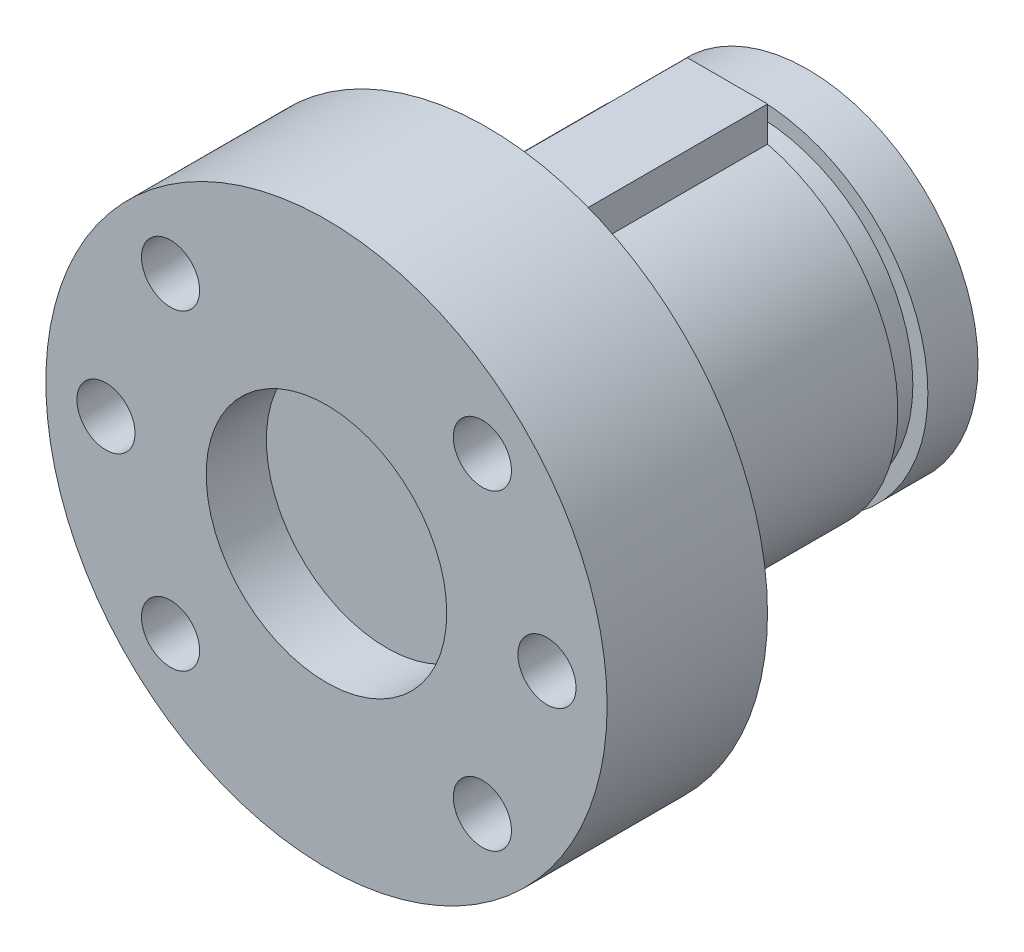
from build123d import *

# Parameters (mm, degrees)
CBORE_FOR_M2_5_SHCS1_AT_2_COUNT = 2
CBORE_FOR_M2_5_SHCS1_AT_2_PITCH = 8.419035512
CBORE_FOR_M2_5_SHCS1_AT_3_COUNT = 2
CBORE_FOR_M2_5_SHCS1_AT_3_PITCH = 20.325349715
CBORE_FOR_M2_5_SHCS1_AT_4_COUNT = 2
CBORE_FOR_M2_5_SHCS1_AT_4_PITCH = 22
CBORE_FOR_M2_5_SHCS1_AT_5_COUNT = 2
CBORE_FOR_M2_5_SHCS1_AT_5_PITCH = 20.325349715
CBORE_FOR_M2_5_SHCS1_AT_6_COUNT = 2
CBORE_FOR_M2_5_SHCS1_AT_6_PITCH = 8.419035512
SKETCH6_W                       = 0.75
SKETCH6_H                       = 1.5
SKETCH8_W                       = 4
SKETCH8_H                       = 4
BOSS_EXTRUDE1_DEPTH             = 12


with BuildPart() as part:
    # Sketch1 → Revolve1 (revolve)
    with BuildSketch(Plane(origin=(0, 0, 0), x_dir=(1, 0, 0), z_dir=(0, 1, 0))):
        Polygon((0, 24), (0, 3), (6, 3), (6, 0), (14, 0), (14, 8), (8.5, 8), (8.5, 24), align=None)
    revolve(axis=Axis((0, 0, 25.877450995), (0, 0, -1)))

    # Sketch4 → CBORE for M2.5 SHCS1 (revolve, cut)
    with BuildSketch(Plane(origin=(-11, 0, -8), x_dir=(0, 1, 0), z_dir=(1, 0, 0))):
        Polygon((0, 0), (0, 8), (1.45, 8), (1.45, 2.5), (2.75, 2.5), (2.75, 0.025), (2.775, 0), align=None)
    cbore_for_m2_5_shcs1 = revolve(axis=Axis((-11, 0, -14.35), (0, 0, 1)), mode=Mode.SUBTRACT)

    # CBORE for M2.5 SHCS1 at 2: CBORE for M2.5 SHCS1 ×2
    with Locations(*[Vector(0.38268343236508967, 0.9238795325112867, 0) * (i * CBORE_FOR_M2_5_SHCS1_AT_2_PITCH) for i in range(1, CBORE_FOR_M2_5_SHCS1_AT_2_COUNT)]):
        add(cbore_for_m2_5_shcs1, mode=Mode.SUBTRACT)

    # CBORE for M2.5 SHCS1 at 3: CBORE for M2.5 SHCS1 ×2
    with Locations(*[Vector(0.9238795325112867, 0.3826834323650897, 0) * (i * CBORE_FOR_M2_5_SHCS1_AT_3_PITCH) for i in range(1, CBORE_FOR_M2_5_SHCS1_AT_3_COUNT)]):
        add(cbore_for_m2_5_shcs1, mode=Mode.SUBTRACT)

    # CBORE for M2.5 SHCS1 at 4: CBORE for M2.5 SHCS1 ×2
    with Locations(*[(i * CBORE_FOR_M2_5_SHCS1_AT_4_PITCH, 0, 0) for i in range(1, CBORE_FOR_M2_5_SHCS1_AT_4_COUNT)]):
        add(cbore_for_m2_5_shcs1, mode=Mode.SUBTRACT)

    # CBORE for M2.5 SHCS1 at 5: CBORE for M2.5 SHCS1 ×2
    with Locations(*[Vector(0.9238795325112867, -0.38268343236508984, 0) * (i * CBORE_FOR_M2_5_SHCS1_AT_5_PITCH) for i in range(1, CBORE_FOR_M2_5_SHCS1_AT_5_COUNT)]):
        add(cbore_for_m2_5_shcs1, mode=Mode.SUBTRACT)

    # CBORE for M2.5 SHCS1 at 6: CBORE for M2.5 SHCS1 ×2
    with Locations(*[Vector(0.38268343236508967, -0.9238795325112868, 0) * (i * CBORE_FOR_M2_5_SHCS1_AT_6_PITCH) for i in range(1, CBORE_FOR_M2_5_SHCS1_AT_6_COUNT)]):
        add(cbore_for_m2_5_shcs1, mode=Mode.SUBTRACT)

    # Sketch6 → Cut-Revolve1 (revolve, cut)
    with BuildSketch(Plane(origin=(0, 0, 0), x_dir=(1, 0, 0), z_dir=(0, 1, 0))):
        with Locations((8.125, 20.75)):
            Rectangle(SKETCH6_W, SKETCH6_H)
    revolve(axis=Axis((0, 0, 6.058618002), (0, 0, -1)), mode=Mode.SUBTRACT)

    # Sketch8 → Boss-Extrude1 (add)
    with BuildSketch(Plane.XY.offset(-20)):
        with Locations((0, 8)):
            Rectangle(SKETCH8_W, SKETCH8_H)
    extrude(amount=BOSS_EXTRUDE1_DEPTH)


solid = part.part
